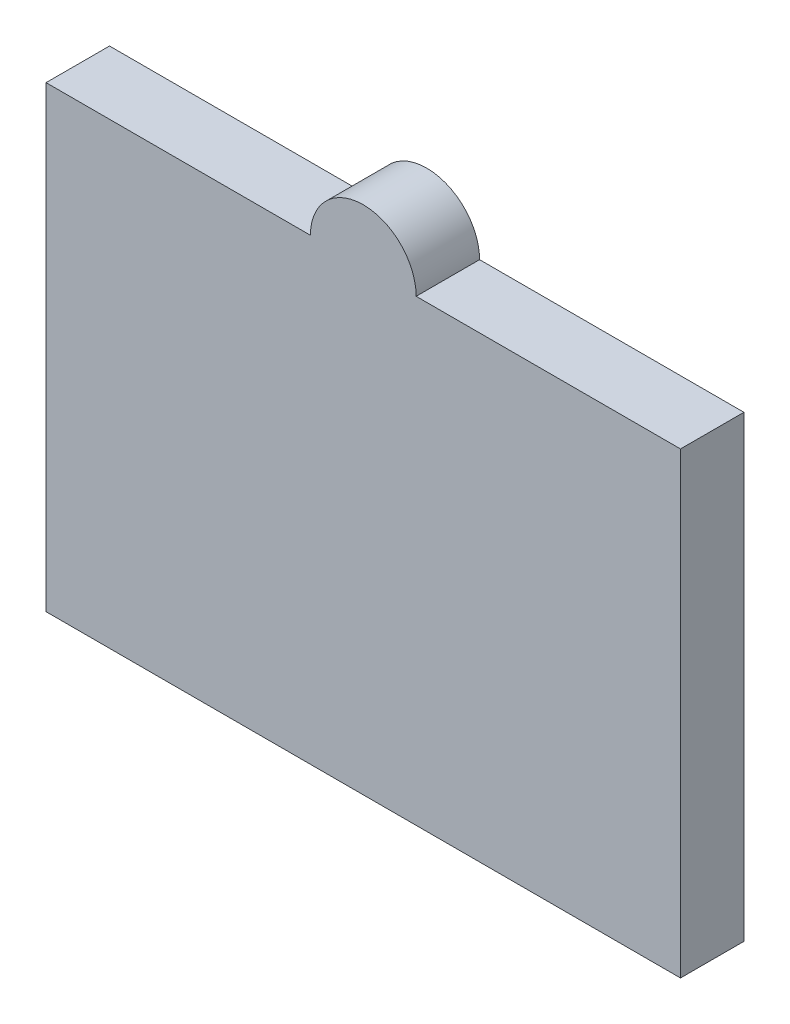
from build123d import *

# Parameters (mm, degrees)
EXTRUDE_1_DEPTH     = 1.8
EXTRUDE_2_DEPTH     = 0.1
SKETCH_3_W          = 16
SKETCH_3_H          = 11
SKETCH_3_W_2        = 15
SKETCH_3_H_2        = 10
CUT_EXTRUDE_3_DEPTH = 0.1
FILLET_1_R          = 0.04


with BuildPart() as part:
    # 草圖1 → 填料-伸長1 (new body)
    with BuildSketch(Plane.XY):
        with BuildLine():
            Line((1.830969267, 5.8356974), (9.330969267, 5.8356974))
            Line((9.330969267, 5.8356974), (9.330969267, -7.1643026))
            Line((9.330969267, -7.1643026), (-8.669030733, -7.1643026))
            Line((-8.669030733, -7.1643026), (-8.669030733, 5.8356974))
            Line((-8.669030733, 5.8356974), (-1.169030733, 5.8356974))
            ThreePointArc((-1.169030733, 5.8356974), (0.330969267, 7.3356974), (1.830969267, 5.8356974))
        make_face()
    extrude(amount=EXTRUDE_1_DEPTH)

    # 草圖2 → 填料-伸長2 (add)
    # profile 1 of 6: a face of its own
    with BuildSketch(Plane(origin=(0, 0, 0), x_dir=(-1, 0, 0), z_dir=(0, 0, -1))):
        Polygon((-5.354044499, -3.785970535), (-5.138098986, -0.285970535), (-5.056067736, -0.285970535), (-4.389300909, -3.157765406), (-3.727441935, -0.285970535), (-3.642606198, -0.285970535), (-3.424557319, -3.785970535), (-3.604745621, -3.785970535), (-3.761095781, -1.273150022), (-4.340222383, -3.785970535), (-4.434873826, -3.785970535), (-5.017506037, -1.273150022), (-5.172453954, -3.785970535), align=None)
    # profile 2 of 6: a face of its own
    with BuildSketch(Plane(origin=(0, 0, 0), x_dir=(-1, 0, 0), z_dir=(0, 0, -1))):
        with BuildLine():
            Line((-1.257249627, -0.883326304), (-1.392566133, -1.138534637))
            add(Edge.make_bspline(
                [(-1.392566133, -1.138534637), (-1.416557614, -1.093209459), (-1.462636475, -1.006156366), (-1.541186071, -0.888411072), (-1.622702349, -0.787445527), (-1.707442126, -0.704404247), (-1.79320935, -0.638543777), (-1.879082981, -0.591246428), (-1.964288141, -0.560727324), (-2.021714683, -0.557003946), (-2.049517255, -0.555201304)],
                knots=[0, 0, 0, 0, 1.33848986, 2.570749574, 3.68977873, 4.721255998, 5.662343939, 6.503516425, 7.275490185, 8, 8, 8, 8], degree=3))
            add(Edge.make_bspline(
                [(-2.049517255, -0.555201304), (-2.066636263, -0.555594723), (-2.100700444, -0.556377565), (-2.151121763, -0.567277453), (-2.201129297, -0.582359436), (-2.250448297, -0.604473573), (-2.29905868, -0.632710625), (-2.346865096, -0.667610109), (-2.394582156, -0.708025045), (-2.440404869, -0.7552583), (-2.485344868, -0.807049397), (-2.528035387, -0.863552487), (-2.567391916, -0.925225652), (-2.604303097, -0.9911434), (-2.639673638, -1.061014322), (-2.670953542, -1.136017635), (-2.700479834, -1.214980756), (-2.735826704, -1.326498205), (-2.772492353, -1.471398041), (-2.804883077, -1.650069719), (-2.824183362, -1.833854943), (-2.826560818, -1.957866898), (-2.827762448, -2.020545855)],
                knots=[0, 0, 0, 0, 0.568730313, 1.131685479, 1.709912873, 2.305463083, 2.925896555, 3.577908701, 4.273175594, 5.004788639, 5.765874873, 6.5546829, 7.359553118, 8.199017488, 9.068753652, 9.964573456, 10.902373305, 11.874145365, 13.8571133, 15.872815753, 17.914010745, 20, 20, 20, 20], degree=3))
            add(Edge.make_bspline(
                [(-2.827762448, -2.020545855), (-2.826733437, -2.084879021), (-2.824696294, -2.212240025), (-2.802863547, -2.400683043), (-2.771680551, -2.584672376), (-2.732903627, -2.733428118), (-2.69559953, -2.847553952), (-2.665146693, -2.928355299), (-2.633812075, -3.005071868), (-2.596835748, -3.075743332), (-2.560885389, -3.143564638), (-2.519407693, -3.205136548), (-2.476959249, -3.262760542), (-2.432235852, -3.31550999), (-2.385132317, -3.36239018), (-2.337138503, -3.404137286), (-2.287064836, -3.438564399), (-2.23622415, -3.466636117), (-2.184947269, -3.489901858), (-2.131701977, -3.50481003), (-2.077758083, -3.515509521), (-2.041156637, -3.516329964), (-2.022874627, -3.516739765)],
                knots=[0, 0, 0, 0, 2.084429355, 4.126565393, 6.141755129, 8.129878717, 9.102521421, 10.032635645, 10.92890699, 11.786065107, 12.616804056, 13.415239791, 14.189480946, 14.936406817, 15.654220662, 16.341982914, 16.995514923, 17.619486705, 18.223312217, 18.815428621, 19.40831992, 20, 20, 20, 20], degree=3))
            add(Edge.make_bspline(
                [(-2.022874627, -3.516739765), (-2.000832051, -3.515754995), (-1.957001418, -3.513796826), (-1.892940904, -3.499356025), (-1.831430194, -3.475919862), (-1.773022101, -3.442254468), (-1.716688222, -3.400190857), (-1.663718346, -3.347920236), (-1.613352136, -3.286755055), (-1.566067033, -3.216615653), (-1.522182747, -3.139281664), (-1.483076254, -3.055408111), (-1.448030237, -2.966484329), (-1.417703194, -2.871899164), (-1.392789127, -2.771834881), (-1.372348739, -2.666062294), (-1.357133675, -2.554844482), (-1.350416161, -2.478644687), (-1.346993217, -2.439816688)],
                knots=[0, 0, 0, 0, 0.762723044, 1.516639164, 2.261995719, 3.033806993, 3.842973972, 4.689859126, 5.603644772, 6.582168229, 7.614926528, 8.679127238, 9.783543831, 10.92228645, 12.115499124, 13.351725146, 14.650557879, 16, 16, 16, 16], degree=3))
            Line((-1.346993217, -2.439816688), (-1.885454755, -2.439816688))
            Line((-1.885454755, -2.439816688), (-1.885454755, -2.08084233))
            Line((-1.885454755, -2.08084233), (-1.167506037, -2.08084233))
            add(Edge.make_bspline(
                [(-1.167506037, -2.08084233), (-1.168400527, -2.14769665), (-1.170147002, -2.278228599), (-1.181181722, -2.468686225), (-1.200179858, -2.64856141), (-1.225623647, -2.817881009), (-1.259338498, -2.976554925), (-1.29967165, -3.124650943), (-1.347311337, -3.262342375), (-1.402279505, -3.388392538), (-1.462648377, -3.50245457), (-1.529252665, -3.601528691), (-1.600046018, -3.686527422), (-1.677239848, -3.755241628), (-1.759132243, -3.809648992), (-1.84660943, -3.848005421), (-1.939173019, -3.871279671), (-2.002642517, -3.874223099), (-2.034793698, -3.875714124)],
                knots=[0, 0, 0, 0, 1.469873806, 2.869904152, 4.192601762, 5.445438261, 6.632594153, 7.756987361, 8.81812787, 9.832884521, 10.777728979, 11.65132866, 12.45332971, 13.203062143, 13.915637326, 14.60587222, 15.293789051, 16, 16, 16, 16], degree=3))
            add(Edge.make_bspline(
                [(-2.034793698, -3.875714124), (-2.054452802, -3.875141538), (-2.093452923, -3.874005631), (-2.151134671, -3.865932373), (-2.207421567, -3.853739839), (-2.261831592, -3.834808237), (-2.315235193, -3.812158541), (-2.366493968, -3.782815805), (-2.41639664, -3.749331271), (-2.464445224, -3.710090645), (-2.511262323, -3.666224431), (-2.556135554, -3.616709243), (-2.59983207, -3.562508757), (-2.64177433, -3.503038614), (-2.681690189, -3.437866444), (-2.720984763, -3.368170284), (-2.758070739, -3.2928843), (-2.780989745, -3.240589303), (-2.792706358, -3.21385515)],
                knots=[0, 0, 0, 0, 0.881331346, 1.748402658, 2.60777613, 3.459511146, 4.327848256, 5.205307796, 6.103489059, 7.020069153, 7.983902463, 8.97791718, 10.013970342, 11.104360802, 12.238593499, 13.439750179, 14.691153768, 16, 16, 16, 16], degree=3))
            add(Edge.make_bspline(
                [(-2.792706358, -3.21385515), (-2.810093619, -3.170825387), (-2.845235747, -3.083856119), (-2.888005501, -2.948483883), (-2.924664096, -2.808295191), (-2.954589487, -2.663166197), (-2.978586534, -2.513009947), (-2.99523661, -2.357861252), (-3.005118151, -2.197825789), (-3.006532398, -2.089503479), (-3.007249627, -2.034568291)],
                knots=[0, 0, 0, 0, 0.922906733, 1.865325729, 2.82154162, 3.804429891, 4.811795581, 5.845266584, 6.907236329, 8, 8, 8, 8], degree=3))
            add(Edge.make_bspline(
                [(-3.007249627, -2.034568291), (-3.005802641, -1.952950997), (-3.00295656, -1.792417713), (-2.979460676, -1.555945865), (-2.940111439, -1.328294331), (-2.895019618, -1.145215578), (-2.852415793, -1.00511722), (-2.816109817, -0.906990412), (-2.7787794, -0.81390889), (-2.737187957, -0.727379951), (-2.693913028, -0.645989007), (-2.646731337, -0.571022848), (-2.597193814, -0.50144329), (-2.544507555, -0.438113296), (-2.489497861, -0.381524021), (-2.432629988, -0.332050208), (-2.373885934, -0.290345708), (-2.313684238, -0.255376969), (-2.250711257, -0.229625497), (-2.186607687, -0.210661862), (-2.120840893, -0.19781046), (-2.07622025, -0.196757708), (-2.053723986, -0.196226945)],
                knots=[0, 0, 0, 0, 2.168306479, 4.264848059, 6.306663948, 8.302261787, 9.270616845, 10.195881339, 11.081517014, 11.934255628, 12.745559722, 13.529524479, 14.286053934, 15.013558637, 15.716175453, 16.38097526, 17.01334198, 17.627989569, 18.226521722, 18.815965006, 19.40304841, 20, 20, 20, 20], degree=3))
            add(Edge.make_bspline(
                [(-2.053723986, -0.196226945), (-2.017302881, -0.198376366), (-1.944161518, -0.202692864), (-1.836460818, -0.234235139), (-1.733031857, -0.286701336), (-1.651227297, -0.346147834), (-1.588220225, -0.404227569), (-1.539620387, -0.454192191), (-1.491304388, -0.510307621), (-1.443601413, -0.572851944), (-1.39682855, -0.64211272), (-1.349217731, -0.716699238), (-1.302022933, -0.797533499), (-1.272439965, -0.854219191), (-1.257249627, -0.883326304)],
                knots=[0, 0, 0, 0, 1.183363695, 2.376447173, 3.616871378, 4.939311932, 5.649330149, 6.401679791, 7.204491918, 8.055625454, 8.957745006, 9.921154323, 10.932549062, 12, 12, 12, 12], degree=3))
        make_face()
    # profile 3 of 6: a face of its own
    with BuildSketch(Plane(origin=(0, 0, 0), x_dir=(-1, 0, 0), z_dir=(0, 0, -1))):
        with BuildLine():
            Line((-0.436095781, -3.875714124), (-0.58823921, -3.683606753))
            Line((-0.58823921, -3.683606753), (-0.116384242, -2.261030631))
            add(Edge.make_bspline(
                [(-0.116384242, -2.261030631), (-0.13165041, -2.268007313), (-0.161336585, -2.28157398), (-0.207082477, -2.294150984), (-0.251082876, -2.303599209), (-0.280164606, -2.304673089), (-0.294469178, -2.305201304)],
                knots=[0, 0, 0, 0, 1.087524263, 2.114770172, 3.072702809, 4, 4, 4, 4], degree=3))
            add(Edge.make_bspline(
                [(-0.294469178, -2.305201304), (-0.311635049, -2.304236613), (-0.345841854, -2.302314253), (-0.395838932, -2.287265008), (-0.444132454, -2.26425984), (-0.489282707, -2.229999576), (-0.532952679, -2.18772516), (-0.574370734, -2.135623579), (-0.614273375, -2.074731946), (-0.650669513, -2.004628123), (-0.684909305, -1.928486937), (-0.714041137, -1.846752885), (-0.739679339, -1.760981211), (-0.759416361, -1.670652248), (-0.776000599, -1.57621217), (-0.786660529, -1.477366591), (-0.794135463, -1.374226945), (-0.794754671, -1.30401376), (-0.79507014, -1.268242169)],
                knots=[0, 0, 0, 0, 0.65922881, 1.313659585, 1.993110193, 2.706896685, 3.482480901, 4.3262308, 5.261204227, 6.278584688, 7.361076839, 8.470080821, 9.613525185, 10.802085807, 12.024266749, 13.299892168, 14.624373034, 16, 16, 16, 16], degree=3))
            add(Edge.make_bspline(
                [(-0.79507014, -1.268242169), (-0.794381181, -1.219361464), (-0.793036796, -1.123979161), (-0.779111528, -0.984653597), (-0.758069744, -0.852559232), (-0.726977638, -0.728690103), (-0.689439817, -0.614019636), (-0.642905191, -0.510962783), (-0.589713023, -0.419500243), (-0.529393487, -0.341167135), (-0.463890786, -0.277686802), (-0.395472027, -0.230494637), (-0.323248571, -0.201835917), (-0.273901231, -0.198077826), (-0.249597383, -0.196226945)],
                knots=[0, 0, 0, 0, 1.346507841, 2.627478836, 3.854542036, 5.02910817, 6.143073727, 7.174916586, 8.139128419, 9.052446673, 9.89053373, 10.642494798, 11.331420893, 12, 12, 12, 12], degree=3))
            add(Edge.make_bspline(
                [(-0.249597383, -0.196226945), (-0.225520457, -0.19807148), (-0.17713431, -0.201778347), (-0.106728919, -0.229897331), (-0.040281543, -0.275182046), (0.022002611, -0.33811892), (0.079514867, -0.416030833), (0.131835223, -0.508162395), (0.176046952, -0.614858664), (0.213751225, -0.733400456), (0.244522605, -0.860837073), (0.265674653, -0.994021524), (0.279755972, -1.131454672), (0.281146767, -1.224502937), (0.281852937, -1.271747778)],
                knots=[0, 0, 0, 0, 0.664990051, 1.336395901, 2.068218511, 2.877652116, 3.774006432, 4.74140905, 5.802048931, 6.963734505, 8.180959779, 9.42597482, 10.693050225, 12, 12, 12, 12], degree=3))
            add(Edge.make_bspline(
                [(0.281852937, -1.271747778), (0.281245034, -1.308452064), (0.28001635, -1.382638124), (0.272041697, -1.495412467), (0.258809347, -1.610760001), (0.239312415, -1.730234367), (0.214073164, -1.856996767), (0.178668928, -1.993673608), (0.137230611, -2.143162784), (0.103720195, -2.24596631), (0.086239956, -2.29959233)],
                knots=[0, 0, 0, 0, 0.838198954, 1.69415306, 2.580596277, 3.488737395, 4.457978626, 5.531070585, 6.712117563, 8, 8, 8, 8], degree=3))
            Line((0.086239956, -2.29959233), (-0.436095781, -3.875714124))
        make_face()
        with BuildLine():
            add(Edge.make_bspline(
                [(-0.252401871, -1.946226945), (-0.239971122, -1.945433617), (-0.215250789, -1.943855969), (-0.178891068, -1.93479555), (-0.144725618, -1.918011115), (-0.112454818, -1.895172625), (-0.080995106, -1.866765129), (-0.051862842, -1.831246387), (-0.023706605, -1.789829236), (0.010964758, -1.724995627), (0.047791247, -1.634450541), (0.080139446, -1.515906315), (0.099011917, -1.386634958), (0.101222384, -1.297051548), (0.102365758, -1.250714124)],
                knots=[0, 0, 0, 0, 0.527335119, 1.048681853, 1.575923927, 2.130998836, 2.720036277, 3.366874046, 4.072966174, 4.839813507, 6.478846259, 8.204265198, 10.03663904, 12, 12, 12, 12], degree=3))
            add(Edge.make_bspline(
                [(0.102365758, -1.250714124), (0.101293994, -1.204365608), (0.099221168, -1.114726001), (0.079395089, -0.985731672), (0.046643939, -0.867086293), (0.007614083, -0.777209818), (-0.027865397, -0.712240303), (-0.056764038, -0.671017498), (-0.086144658, -0.635415357), (-0.117184027, -0.605974837), (-0.150268717, -0.583651254), (-0.184472306, -0.566592979), (-0.220639435, -0.55764488), (-0.245116711, -0.556013802), (-0.257309723, -0.555201304)],
                knots=[0, 0, 0, 0, 1.959846727, 3.79041019, 5.505858152, 7.153480099, 7.923729759, 8.63415393, 9.27983392, 9.874513442, 10.436740291, 10.963038651, 11.483452223, 12, 12, 12, 12], degree=3))
            add(Edge.make_bspline(
                [(-0.257309723, -0.555201304), (-0.269510697, -0.555987398), (-0.293777774, -0.557550898), (-0.329611149, -0.566779086), (-0.363588105, -0.583403259), (-0.396119005, -0.60645386), (-0.427812071, -0.635110586), (-0.457112582, -0.67106856), (-0.48605038, -0.712231515), (-0.52157671, -0.777097389), (-0.559644153, -0.867276506), (-0.592682626, -0.985702168), (-0.612418823, -1.114734201), (-0.614504535, -1.204368403), (-0.61558296, -1.250714124)],
                knots=[0, 0, 0, 0, 0.517165827, 1.028614833, 1.555542909, 2.110287244, 2.71295889, 3.359411436, 4.07068563, 4.841856894, 6.487554088, 8.205054584, 10.037808316, 12, 12, 12, 12], degree=3))
            add(Edge.make_bspline(
                [(-0.61558296, -1.250714124), (-0.614600139, -1.297075596), (-0.612698567, -1.386776253), (-0.591623082, -1.515853577), (-0.559200378, -1.634767521), (-0.520523342, -1.725279256), (-0.483830275, -1.789688061), (-0.455081664, -1.831305181), (-0.425192628, -1.866795736), (-0.393049661, -1.895224167), (-0.360190649, -1.917831039), (-0.325928363, -1.934819772), (-0.289548996, -1.943849861), (-0.264831295, -1.945431573), (-0.252401871, -1.946226945)],
                knots=[0, 0, 0, 0, 1.954501469, 3.781589718, 5.50185334, 7.144981586, 7.917988834, 8.626475405, 9.276780754, 9.870493849, 10.431187289, 10.95605023, 11.475044433, 12, 12, 12, 12], degree=3))
        make_face(mode=Mode.SUBTRACT)
    # profile 4 of 6: a face of its own
    with BuildSketch(Plane(origin=(0, 0, 0), x_dir=(-1, 0, 0), z_dir=(0, 0, -1))):
        with BuildLine():
            Line((1.058134988, -3.875714124), (0.905991559, -3.683606753))
            Line((0.905991559, -3.683606753), (1.377846527, -2.261030631))
            add(Edge.make_bspline(
                [(1.377846527, -2.261030631), (1.362580359, -2.268007313), (1.332894184, -2.28157398), (1.287148292, -2.294150984), (1.243147893, -2.303599209), (1.214066163, -2.304673089), (1.199761591, -2.305201304)],
                knots=[0, 0, 0, 0, 1.087524263, 2.114770172, 3.072702809, 4, 4, 4, 4], degree=3))
            add(Edge.make_bspline(
                [(1.199761591, -2.305201304), (1.18259572, -2.304236613), (1.148388915, -2.302314253), (1.098391837, -2.287265008), (1.050098315, -2.26425984), (1.004948062, -2.229999576), (0.96127809, -2.18772516), (0.919860035, -2.135623579), (0.879957394, -2.074731946), (0.843561256, -2.004628123), (0.809321464, -1.928486937), (0.780189632, -1.846752885), (0.75455143, -1.760981211), (0.734814408, -1.670652248), (0.71823017, -1.57621217), (0.70757024, -1.477366591), (0.700095307, -1.374226945), (0.699476098, -1.30401376), (0.699160629, -1.268242169)],
                knots=[0, 0, 0, 0, 0.65922881, 1.313659585, 1.993110193, 2.706896685, 3.482480901, 4.3262308, 5.261204227, 6.278584688, 7.361076839, 8.470080821, 9.613525185, 10.802085807, 12.024266749, 13.299892168, 14.624373034, 16, 16, 16, 16], degree=3))
            add(Edge.make_bspline(
                [(0.699160629, -1.268242169), (0.699849588, -1.219361464), (0.701193973, -1.123979161), (0.715119242, -0.984653597), (0.736161025, -0.852559232), (0.767253131, -0.728690103), (0.804790952, -0.614019636), (0.851325579, -0.510962783), (0.904517746, -0.419500243), (0.964837282, -0.341167135), (1.030339983, -0.277686802), (1.098758743, -0.230494637), (1.170982199, -0.201835917), (1.220329538, -0.198077826), (1.244633386, -0.196226945)],
                knots=[0, 0, 0, 0, 1.346507841, 2.627478836, 3.854542036, 5.02910817, 6.143073727, 7.174916586, 8.139128419, 9.052446673, 9.89053373, 10.642494798, 11.331420893, 12, 12, 12, 12], degree=3))
            add(Edge.make_bspline(
                [(1.244633386, -0.196226945), (1.268710313, -0.19807148), (1.31709646, -0.201778347), (1.38750185, -0.229897331), (1.453949226, -0.275182046), (1.51623338, -0.33811892), (1.573745637, -0.416030833), (1.626065992, -0.508162395), (1.670277721, -0.614858664), (1.707981994, -0.733400456), (1.738753374, -0.860837073), (1.759905422, -0.994021524), (1.773986741, -1.131454672), (1.775377536, -1.224502937), (1.776083706, -1.271747778)],
                knots=[0, 0, 0, 0, 0.664990051, 1.336395901, 2.068218511, 2.877652116, 3.774006432, 4.74140905, 5.802048931, 6.963734505, 8.180959779, 9.42597482, 10.693050225, 12, 12, 12, 12], degree=3))
            add(Edge.make_bspline(
                [(1.776083706, -1.271747778), (1.775475803, -1.308452064), (1.774247119, -1.382638124), (1.766272467, -1.495412467), (1.753040116, -1.610760001), (1.733543185, -1.730234367), (1.708303933, -1.856996767), (1.672899697, -1.993673608), (1.63146138, -2.143162784), (1.597950964, -2.24596631), (1.580470726, -2.29959233)],
                knots=[0, 0, 0, 0, 0.838198954, 1.69415306, 2.580596277, 3.488737395, 4.457978626, 5.531070585, 6.712117563, 8, 8, 8, 8], degree=3))
            Line((1.580470726, -2.29959233), (1.058134988, -3.875714124))
        make_face()
        with BuildLine():
            add(Edge.make_bspline(
                [(1.241828899, -1.946226945), (1.254259647, -1.945433617), (1.27897998, -1.943855969), (1.315339701, -1.93479555), (1.349505151, -1.918011115), (1.381775951, -1.895172625), (1.413235664, -1.866765129), (1.442367927, -1.831246387), (1.470524164, -1.789829236), (1.505195527, -1.724995627), (1.542022016, -1.634450541), (1.574370215, -1.515906315), (1.593242686, -1.386634958), (1.595453153, -1.297051548), (1.596596527, -1.250714124)],
                knots=[0, 0, 0, 0, 0.527335119, 1.048681853, 1.575923927, 2.130998836, 2.720036277, 3.366874046, 4.072966174, 4.839813507, 6.478846259, 8.204265198, 10.03663904, 12, 12, 12, 12], degree=3))
            add(Edge.make_bspline(
                [(1.596596527, -1.250714124), (1.595524764, -1.204365608), (1.593451937, -1.114726001), (1.573625858, -0.985731672), (1.540874708, -0.867086293), (1.501844853, -0.777209818), (1.466365372, -0.712240303), (1.437466732, -0.671017498), (1.408086111, -0.635415357), (1.377046742, -0.605974837), (1.343962052, -0.583651254), (1.309758463, -0.566592979), (1.273591335, -0.55764488), (1.249114058, -0.556013802), (1.236921046, -0.555201304)],
                knots=[0, 0, 0, 0, 1.959846727, 3.79041019, 5.505858152, 7.153480099, 7.923729759, 8.63415393, 9.27983392, 9.874513442, 10.436740291, 10.963038651, 11.483452223, 12, 12, 12, 12], degree=3))
            add(Edge.make_bspline(
                [(1.236921046, -0.555201304), (1.224720072, -0.555987398), (1.200452995, -0.557550898), (1.16461962, -0.566779086), (1.130642664, -0.583403259), (1.098111764, -0.60645386), (1.066418698, -0.635110586), (1.037118187, -0.67106856), (1.008180389, -0.712231515), (0.97265406, -0.777097389), (0.934586617, -0.867276506), (0.901548143, -0.985702168), (0.881811947, -1.114734201), (0.879726235, -1.204368403), (0.878647809, -1.250714124)],
                knots=[0, 0, 0, 0, 0.517165827, 1.028614833, 1.555542909, 2.110287244, 2.71295889, 3.359411436, 4.07068563, 4.841856894, 6.487554088, 8.205054584, 10.037808316, 12, 12, 12, 12], degree=3))
            add(Edge.make_bspline(
                [(0.878647809, -1.250714124), (0.87963063, -1.297075596), (0.881532202, -1.386776253), (0.902607687, -1.515853577), (0.935030391, -1.634767521), (0.973707427, -1.725279256), (1.010400494, -1.789688061), (1.039149106, -1.831305181), (1.069038141, -1.866795736), (1.101181108, -1.895224167), (1.13404012, -1.917831039), (1.168302406, -1.934819772), (1.204681773, -1.943849861), (1.229399474, -1.945431573), (1.241828899, -1.946226945)],
                knots=[0, 0, 0, 0, 1.954501469, 3.781589718, 5.50185334, 7.144981586, 7.917988834, 8.626475405, 9.276780754, 9.870493849, 10.431187289, 10.95605023, 11.475044433, 12, 12, 12, 12], degree=3))
        make_face(mode=Mode.SUBTRACT)
    # profile 5 of 6: a face of its own
    with BuildSketch(Plane(origin=(0, 0, 0), x_dir=(-1, 0, 0), z_dir=(0, 0, -1))):
        with BuildLine():
            Line((3.001083706, -0.196226945), (3.14691704, -0.407965727))
            Line((3.14691704, -0.407965727), (2.687682264, -1.813013804))
            add(Edge.make_bspline(
                [(2.687682264, -1.813013804), (2.702973269, -1.805906561), (2.732753061, -1.792064944), (2.778132885, -1.777436954), (2.82217756, -1.768479929), (2.851005095, -1.767310277), (2.865066078, -1.766739765)],
                knots=[0, 0, 0, 0, 1.093592758, 2.129811956, 3.087792837, 4, 4, 4, 4], degree=3))
            add(Edge.make_bspline(
                [(2.865066078, -1.766739765), (2.881990858, -1.767732883), (2.915948419, -1.769725455), (2.96558986, -1.784501482), (3.013424491, -1.807930529), (3.058459573, -1.841705707), (3.101374033, -1.884324543), (3.142295181, -1.936118126), (3.18037428, -1.997682602), (3.217327281, -2.067071732), (3.250371661, -2.1436609), (3.279830647, -2.225149823), (3.305165042, -2.310772923), (3.325528178, -2.400937547), (3.340639939, -2.495594251), (3.351740961, -2.594558606), (3.359098841, -2.697718336), (3.359734311, -2.767928731), (3.360058065, -2.8036989)],
                knots=[0, 0, 0, 0, 0.652067061, 1.308295172, 1.98151384, 2.697260683, 3.468522975, 4.30895334, 5.236737342, 6.256911946, 7.338740529, 8.450790292, 9.597375023, 10.780407073, 12.013347756, 13.292476565, 14.620594999, 16, 16, 16, 16], degree=3))
            add(Edge.make_bspline(
                [(3.360058065, -2.8036989), (3.359355548, -2.852577853), (3.357981361, -2.948189448), (3.344192985, -3.087769719), (3.32284492, -3.220497992), (3.292207263, -3.344945586), (3.25441256, -3.460025829), (3.207867092, -3.563059495), (3.154900609, -3.654464152), (3.094348819, -3.732192083), (3.028885258, -3.795047572), (2.960100897, -3.841560666), (2.887521241, -3.87011812), (2.837720333, -3.873867016), (2.813183065, -3.875714124)],
                knots=[0, 0, 0, 0, 1.344463816, 2.629891208, 3.855091701, 5.040359424, 6.152633959, 7.182910461, 8.145658601, 9.052520873, 9.884901717, 10.632160859, 11.326055749, 12, 12, 12, 12], degree=3))
            add(Edge.make_bspline(
                [(2.813183065, -3.875714124), (2.789340246, -3.874134746), (2.741160741, -3.870943275), (2.671288027, -3.842847309), (2.605387576, -3.797820439), (2.542274018, -3.737008241), (2.484505088, -3.660197975), (2.433494355, -3.568638333), (2.388852127, -3.463468362), (2.351019747, -3.345844108), (2.320669734, -3.219248128), (2.299166362, -3.086591482), (2.285281878, -2.949829368), (2.2838568, -2.857018351), (2.283134988, -2.810008996)],
                knots=[0, 0, 0, 0, 0.662369525, 1.338459016, 2.066353562, 2.877025051, 3.769235349, 4.734508272, 5.790567313, 6.947964469, 8.173680948, 9.414528179, 10.690442538, 12, 12, 12, 12], degree=3))
            add(Edge.make_bspline(
                [(2.283134988, -2.810008996), (2.283757743, -2.774006807), (2.285024791, -2.70075724), (2.292843581, -2.589601312), (2.306310209, -2.475688072), (2.325480408, -2.357502507), (2.352049067, -2.232207179), (2.385785485, -2.096226475), (2.428938687, -1.948681158), (2.461681933, -1.846592039), (2.478747969, -1.793382394)],
                knots=[0, 0, 0, 0, 0.830934539, 1.690608154, 2.570402716, 3.47754985, 4.452899284, 5.525626641, 6.710337295, 8, 8, 8, 8], degree=3))
            Line((2.478747969, -1.793382394), (3.001083706, -0.196226945))
        make_face()
        with BuildLine():
            add(Edge.make_bspline(
                [(2.820895405, -2.125714124), (2.808696742, -2.126503588), (2.784434263, -2.128073789), (2.748566358, -2.137251642), (2.714845352, -2.154016663), (2.68185253, -2.176157152), (2.650433593, -2.204981432), (2.621080366, -2.240862252), (2.592157511, -2.282048323), (2.556631664, -2.346907289), (2.51842471, -2.437282927), (2.485548792, -2.556233217), (2.465781464, -2.685949364), (2.463698841, -2.776049343), (2.462622168, -2.822629188)],
                knots=[0, 0, 0, 0, 0.516150102, 1.026594612, 1.552487789, 2.100560272, 2.702048258, 3.347231158, 4.057108394, 4.826765061, 6.469230071, 8.192870344, 10.031791848, 12, 12, 12, 12], degree=3))
            add(Edge.make_bspline(
                [(2.462622168, -2.822629188), (2.463594992, -2.868763492), (2.465481829, -2.958243085), (2.48676001, -3.086704881), (2.518070115, -3.205695045), (2.557424274, -3.295404485), (2.592821059, -3.360433603), (2.621843099, -3.401522567), (2.650849303, -3.437570726), (2.683027862, -3.46545303), (2.715290482, -3.488568443), (2.749302077, -3.505154258), (2.785126731, -3.514392104), (2.809394969, -3.515954317), (2.821596527, -3.516739765)],
                knots=[0, 0, 0, 0, 1.954541373, 3.790922404, 5.507734291, 7.159219678, 7.931275464, 8.64336548, 9.290559498, 9.887292286, 10.442672906, 10.97020536, 11.482240991, 12, 12, 12, 12], degree=3))
            add(Edge.make_bspline(
                [(2.821596527, -3.516739765), (2.8337958, -3.515951181), (2.858059493, -3.514382729), (2.893918281, -3.505191741), (2.927967717, -3.488333961), (2.960773637, -3.465926732), (2.992307625, -3.437263934), (3.021395985, -3.401575576), (3.050353162, -3.360416514), (3.08581061, -3.295423004), (3.124852155, -3.205559285), (3.157599362, -3.086909489), (3.177390785, -2.958148081), (3.179488764, -2.868743414), (3.180570886, -2.822629188)],
                knots=[0, 0, 0, 0, 0.517675877, 1.029629295, 1.557077049, 2.120531757, 2.709798984, 3.356889088, 4.06886477, 4.840796594, 6.492016817, 8.211211181, 10.04577245, 12, 12, 12, 12], degree=3))
            add(Edge.make_bspline(
                [(3.180570886, -2.822629188), (3.17950101, -2.776046428), (3.177431535, -2.685940811), (3.157572467, -2.556264005), (3.124990059, -2.437088451), (3.08580739, -2.347029653), (3.050350464, -2.282041543), (3.021407906, -2.240863489), (2.992058949, -2.204982258), (2.960640138, -2.17615321), (2.927643495, -2.154030011), (2.893733079, -2.137102816), (2.85756563, -2.128158436), (2.833088396, -2.126526867), (2.820895405, -2.125714124)],
                knots=[0, 0, 0, 0, 1.96600346, 3.802865094, 5.524574629, 7.169083954, 7.937878489, 8.646960555, 9.291420752, 9.89223498, 10.439693539, 10.964997637, 11.484428064, 12, 12, 12, 12], degree=3))
        make_face(mode=Mode.SUBTRACT)
    # profile 6 of 6: a face of its own
    with BuildSketch(Plane(origin=(0, 0, 0), x_dir=(-1, 0, 0), z_dir=(0, 0, -1))):
        with BuildLine():
            Line((3.822237552, -0.285970535), (4.179809668, -0.285970535))
            add(Edge.make_bspline(
                [(4.179809668, -0.285970535), (4.20364728, -0.286125167), (4.249463017, -0.286422368), (4.315200306, -0.288105953), (4.374748388, -0.292827473), (4.428424887, -0.297030346), (4.475798782, -0.304453777), (4.517632315, -0.311680219), (4.553384409, -0.321172677), (4.574607075, -0.329720072), (4.584356943, -0.333646817)],
                knots=[0, 0, 0, 0, 1.396932602, 2.684895432, 3.851846456, 4.897053615, 5.838313078, 6.660226865, 7.384497111, 8, 8, 8, 8], degree=3))
            add(Edge.make_bspline(
                [(4.584356943, -0.333646817), (4.597650701, -0.340062602), (4.624570012, -0.353054302), (4.66167071, -0.379592421), (4.696839443, -0.410856943), (4.730955429, -0.44640469), (4.761263591, -0.488734642), (4.79184907, -0.534434715), (4.818945231, -0.586457997), (4.854005765, -0.663105512), (4.891662751, -0.769087359), (4.921438581, -0.908367517), (4.940893879, -1.060629485), (4.942958208, -1.16674745), (4.944032424, -1.221968131)],
                knots=[0, 0, 0, 0, 0.52807617, 1.069332505, 1.627050354, 2.213510198, 2.829818747, 3.489432448, 4.182481638, 4.928166571, 6.509293787, 8.199563212, 10.02236404, 12, 12, 12, 12], degree=3))
            add(Edge.make_bspline(
                [(4.944032424, -1.221968131), (4.943353568, -1.268513331), (4.94203719, -1.358769615), (4.928222278, -1.48972987), (4.907061054, -1.612264434), (4.876426807, -1.725377351), (4.838325916, -1.827689691), (4.793166388, -1.918167865), (4.738708197, -1.994518905), (4.676979143, -2.058891276), (4.60427598, -2.109716162), (4.518768441, -2.144384829), (4.421632552, -2.166473189), (4.352649373, -2.169172504), (4.316528418, -2.170585919)],
                knots=[0, 0, 0, 0, 1.30318405, 2.527017854, 3.683902417, 4.782720662, 5.80395304, 6.737809769, 7.606020839, 8.420689625, 9.225063989, 10.069965136, 10.989395644, 12, 12, 12, 12], degree=3))
            Line((4.316528418, -2.170585919), (4.944032424, -3.785970535))
            Line((4.944032424, -3.785970535), (4.716868963, -3.785970535))
            Line((4.716868963, -3.785970535), (4.089364956, -2.170585919))
            Line((4.089364956, -2.170585919), (4.001724732, -2.170585919))
            Line((4.001724732, -2.170585919), (4.001724732, -3.785970535))
            Line((4.001724732, -3.785970535), (3.822237552, -3.785970535))
            Line((3.822237552, -3.785970535), (3.822237552, -0.285970535))
        make_face()
        with BuildLine():
            Line((4.001724732, -0.644944894), (4.001724732, -1.81161156))
            Line((4.001724732, -1.81161156), (4.313022809, -1.816519413))
            add(Edge.make_bspline(
                [(4.313022809, -1.816519413), (4.341351094, -1.815782821), (4.394089787, -1.81441151), (4.467545202, -1.802747128), (4.529694191, -1.783141149), (4.581201072, -1.753147964), (4.623471187, -1.71385198), (4.659761083, -1.665466072), (4.690959984, -1.607697225), (4.717144876, -1.540941161), (4.738490978, -1.467719107), (4.753936517, -1.389130921), (4.76314074, -1.306559245), (4.764071493, -1.250036816), (4.764545245, -1.221267009)],
                knots=[0, 0, 0, 0, 1.187938433, 2.211581827, 3.110816996, 3.906282281, 4.690548415, 5.516203012, 6.43338284, 7.43667608, 8.519609603, 9.629206102, 10.793270513, 12, 12, 12, 12], degree=3))
            add(Edge.make_bspline(
                [(4.764545245, -1.221267009), (4.76407787, -1.193196417), (4.763159993, -1.138068532), (4.753849796, -1.057381416), (4.73862999, -0.980601028), (4.716908153, -0.908892756), (4.691108421, -0.843864387), (4.660986379, -0.787502359), (4.626740664, -0.741076346), (4.586599857, -0.704113224), (4.537558399, -0.675949321), (4.47646099, -0.658180409), (4.403012019, -0.646081552), (4.349543142, -0.645342877), (4.320735149, -0.644944894)],
                knots=[0, 0, 0, 0, 1.205235141, 2.36696338, 3.483174795, 4.562907058, 5.580668413, 6.483535164, 7.300634984, 8.046766767, 8.811241958, 9.706487552, 10.764300017, 12, 12, 12, 12], degree=3))
            Line((4.320735149, -0.644944894), (4.001724732, -0.644944894))
        make_face(mode=Mode.SUBTRACT)
    extrude(amount=EXTRUDE_2_DEPTH)

    # 草圖3 → 除料-伸長3 (cut)
    with BuildSketch(Plane(origin=(0, 0, 0), x_dir=(-1, 0, 0), z_dir=(0, 0, -1))):
        with Locations((-0.330969267, -0.6643026)):
            Rectangle(SKETCH_3_W, SKETCH_3_H)
        with Locations((-0.330969267, -0.6643026)):
            Rectangle(SKETCH_3_W_2, SKETCH_3_H_2, mode=Mode.SUBTRACT)
    extrude(amount=-CUT_EXTRUDE_3_DEPTH, mode=Mode.SUBTRACT)

    # 圓角1
    fillet_1_edges = [part.edges().sort_by_distance(p)[0] for p in [
        (8.330969267, -0.6643026, 0),
        (0.330969267, -6.1643026, 0),
        (-7.669030733, -0.6643026, 0),
        (0.330969267, 4.8356974, 0),
    ]]
    fillet(fillet_1_edges, radius=FILLET_1_R)


solid = part.part
